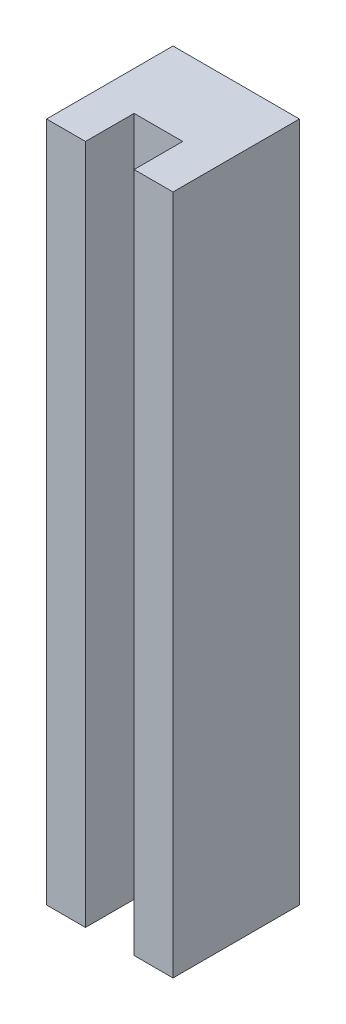
from build123d import *

# Parameters (mm, degrees)
SKETCH1_W               = 6.5
SKETCH1_H               = 6.5
BOSS_EXTRUDE1_DEPTH     = 35
CUT_EXTRUDE1_DEPTH      = 37.187014245
CUT_EXTRUDE1_DEPTH_BACK = 37.187014245
SKETCH2_W               = 2.5
SKETCH2_H               = 2.5


with BuildPart() as part:
    # Sketch1 → Boss-Extrude1 (new body)
    with BuildSketch(Plane(origin=(0, 0, 0), x_dir=(1, 0, 0), z_dir=(0, 1, 0))):
        with Locations((3.25, -3.25)):
            Rectangle(SKETCH1_W, SKETCH1_H)
    extrude(amount=BOSS_EXTRUDE1_DEPTH)

    # Sketch2 → Cut-Extrude1 (cut, two sides: drawn at the far end of the back side and taken through both)
    with BuildSketch(Plane(origin=(0, 35, 0), x_dir=(1, 0, 0), z_dir=(0, 1, 0)).offset(-CUT_EXTRUDE1_DEPTH_BACK)):
        with Locations((3.25, -5.25)):
            Rectangle(SKETCH2_W, SKETCH2_H)
    extrude(amount=CUT_EXTRUDE1_DEPTH + CUT_EXTRUDE1_DEPTH_BACK, mode=Mode.SUBTRACT)


solid = part.part
